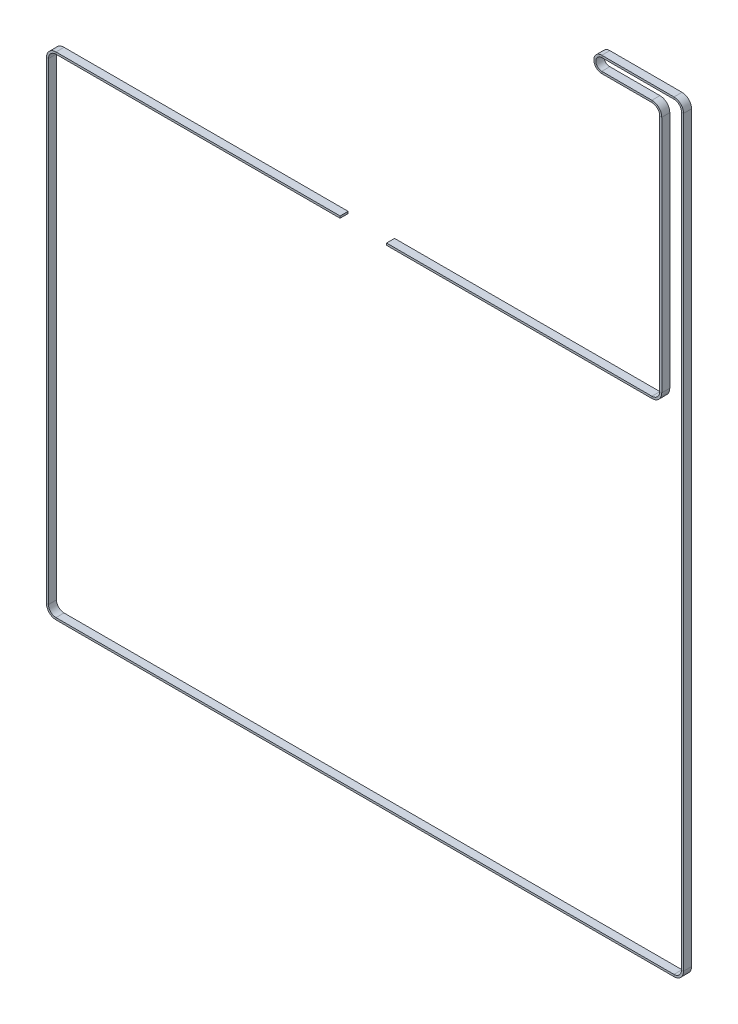
from build123d import *

# Parameters (mm, degrees)
SKETCH4_W = 6
SKETCH4_H = 1.5


with BuildPart() as part:
    # Sweep1: sweep along a path in Sketch1
    with BuildLine(Plane.XY) as sweep1_path:
        Line((181.702805282, -344.154739508), (-30.687774041, -344.154739508))
        ThreePointArc((-30.687774041, -344.154739508), (-35.195579771, -346.021933778), (-37.062774041, -350.529739508))
        Line((-37.062774041, -350.529739508), (-37.062774041, -703.985411885))
        ThreePointArc((-37.062774041, -703.985411885), (-35.195579771, -708.493217615), (-30.687774041, -710.360411885))
        Line((-30.687774041, -710.360411885), (431.312225959, -710.360411885))
        ThreePointArc((431.312225959, -710.360411885), (435.820031689, -708.493217615), (437.687225959, -703.985411885))
        Line((437.687225959, -703.985411885), (437.687225959, -148.660411885))
        ThreePointArc((437.687225959, -148.660411885), (435.820031689, -144.152606155), (431.312225959, -142.285411885))
        Line((431.312225959, -142.285411885), (377.312225959, -142.285411885))
        ThreePointArc((377.312225959, -142.285411885), (372.112225959, -147.485411885), (377.312225959, -152.685411885))
        Line((377.312225959, -152.685411885), (414.812225959, -152.685411885))
        ThreePointArc((414.812225959, -152.685411885), (419.479130714, -154.618507129), (421.412225959, -159.285411885))
        Line((421.412225959, -159.285411885), (421.412225959, -337.704734082))
        ThreePointArc((421.412225959, -337.704734082), (419.479130203, -342.371640074), (414.812224211, -344.30473583))
        Line((414.812224211, -344.30473583), (216.402805282, -344.30473583))
    # Sketch4 → Sweep1 (sweep)
    with BuildSketch(Plane(origin=(181.702805282, -344.154739508, 0), x_dir=(0, 0, -1), z_dir=(1, 0, 0))):
        Rectangle(SKETCH4_W, SKETCH4_H)
    sweep(path=sweep1_path.line)


solid = part.part
